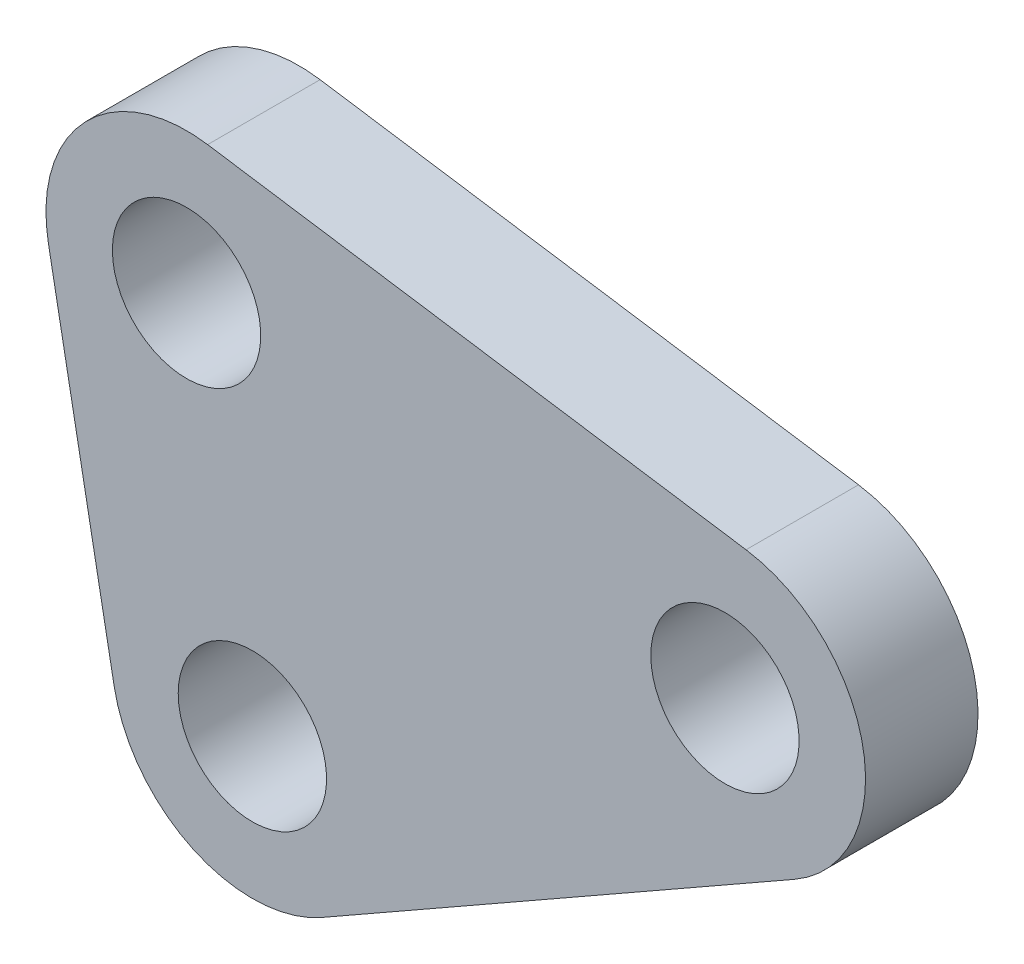
from build123d import *

# Parameters (mm, degrees)
SKETCH1_R           = 2.6375
BOSS_EXTRUDE1_DEPTH = 4


with BuildPart() as part:
    # Sketch1 → Boss-Extrude1 (new body)
    with BuildSketch(Plane.XY.offset(4)):
        with BuildLine():
            Line((46.037988185, 74.138222759), (26.891590001, 77.042584155))
            ThreePointArc((26.891590001, 77.042584155), (22.54509271, 75.572516008), (21.227396241, 71.177426126))
            Line((21.227396241, 71.177426126), (23.568249259, 58.696629092))
            ThreePointArc((23.568249259, 58.696629092), (26.381296021, 55.081304051), (30.958043521, 55.274150009))
            Line((30.958043521, 55.274150009), (47.763588686, 64.850585648))
            ThreePointArc((47.763588686, 64.850585648), (50.20397723, 70.108121575), (46.037988185, 74.138222759))
        make_face()
        with Locations(Location((45.288105172, 69.194775028, 0), (0, 0, 180))):
            Circle(SKETCH1_R, mode=Mode.SUBTRACT)
        with Locations(Location((26.141706988, 72.099136424, 0), (0, 0, 180))):
            Circle(SKETCH1_R, mode=Mode.SUBTRACT)
        with Locations(Location((28.482560007, 59.618339389, 0), (0, 0, 180))):
            Circle(SKETCH1_R, mode=Mode.SUBTRACT)
    extrude(amount=-BOSS_EXTRUDE1_DEPTH)


solid = part.part
